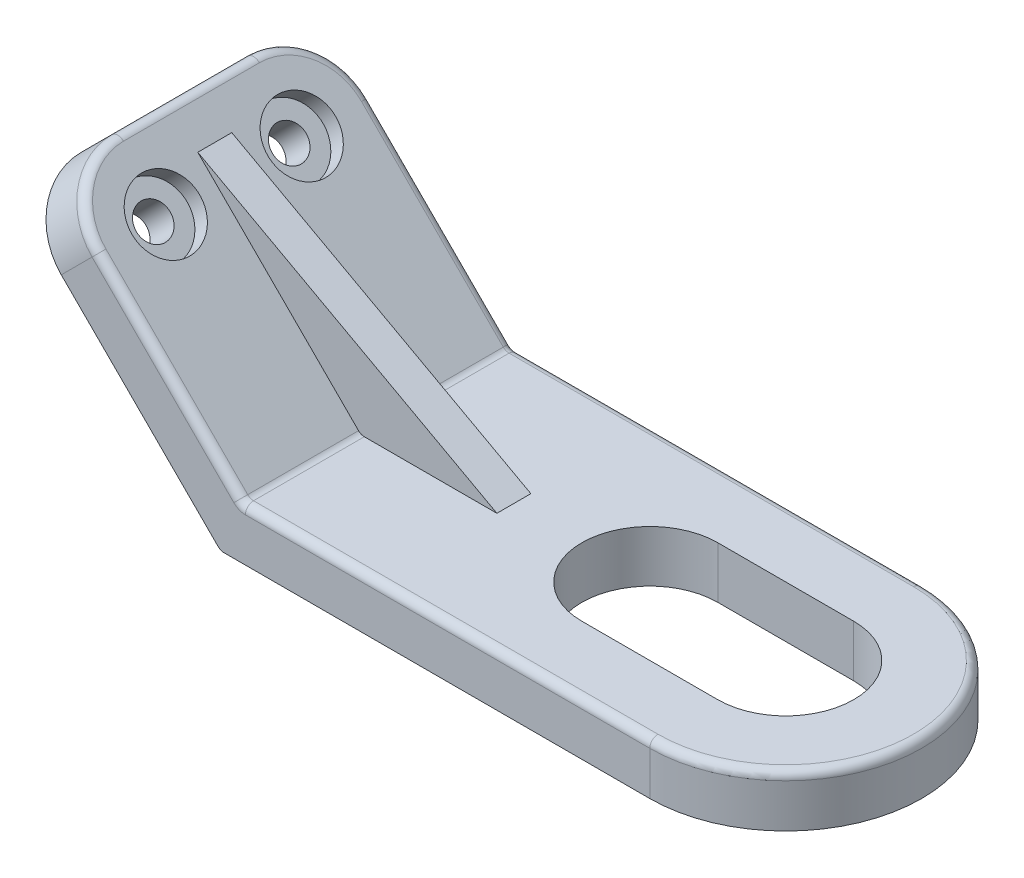
from build123d import *

# Parameters (mm, degrees)
EXTRUDE_THIN1_DEPTH                                 = 25.4
CUT_EXTRUDE1_DEPTH                                  = 111.716033166
CBORE_FOR_00_BINDING_HEAD_MACHINE_SCREW_D           = 6.35
CBORE_FOR_00_BINDING_HEAD_MACHINE_SCREW_CBORE_D     = 12.7
CBORE_FOR_00_BINDING_HEAD_MACHINE_SCREW_CBORE_DEPTH = 3.302
RIB1_REACH                                          = 112.716
SKETCH6_WALL_W                                      = 287.08428389
SKETCH6_WALL_H                                      = 6.35
FILLET1_R                                           = 12.7
FILLET2_R                                           = 1.524
FILLET3_RADIUS                                      = 25.4
FILLET3_LENGTH                                      = 9.652
FILLET4_R                                           = 1.524


with BuildPart() as part:
    # Sketch2 → Extrude-Thin1 (new, symmetric)
    with BuildSketch(Plane.XY):
        Polygon((-35.921024484, 35.921024484), (0, 0), (101.6, 0), (101.6, -9.652), (-3.997989304, -9.652), (-42.746019136, 29.096029832), align=None)
    extrude(amount=EXTRUDE_THIN1_DEPTH, both=True)

    # Sketch3 → Cut-Extrude1 (cut, through all)
    with BuildSketch(Plane(origin=(0, 0, 0), x_dir=(1, 0, 0), z_dir=(0, 1, 0))):
        with BuildLine():
            Line((50.8, 12.7), (76.2, 12.7))
            ThreePointArc((76.2, 12.7), (88.9, 0), (76.2, -12.7))
            Line((76.2, -12.7), (50.8, -12.7))
            ThreePointArc((50.8, -12.7), (38.1, 0), (50.8, 12.7))
        make_face()
    extrude(amount=-CUT_EXTRUDE1_DEPTH, mode=Mode.SUBTRACT)

    # CBORE for #00 Binding Head Machine Screw1 (through all)
    with Locations(Plane(origin=(0, 0, 0), x_dir=(0.7071067811865513, -0.7071067811865438, 0), z_dir=(0.7071067811865438, 0.7071067811865513, 0))):
        with Locations((-38.1, -12.7)):
            cbore_for_00_binding_head_machine_screw = CounterBoreHole(CBORE_FOR_00_BINDING_HEAD_MACHINE_SCREW_D / 2, CBORE_FOR_00_BINDING_HEAD_MACHINE_SCREW_CBORE_D / 2, CBORE_FOR_00_BINDING_HEAD_MACHINE_SCREW_CBORE_DEPTH)

    # Mirror1: CBORE for #00 Binding Head Machine Screw1 across plane
    add(cbore_for_00_binding_head_machine_screw.mirror(Plane.XY), mode=Mode.SUBTRACT)

    # Sketch6 wall → Rib1 (add, up to next)
    with BuildSketch(Plane(origin=(-2.54, 15.24, 0), x_dir=(0.877895572914, -0.478852130681, 0), z_dir=(0.478852130681, 0.877895572914, 0)), mode=Mode.PRIVATE) as rib1_sk1:
        Rectangle(SKETCH6_WALL_W, SKETCH6_WALL_H)
    rib1_tool1 = extrude(rib1_sk1.sketch, amount=-RIB1_REACH, mode=Mode.PRIVATE) - part.part
    add(rib1_tool1.solids().sort_by_distance((-2.54, 15.24, 0))[0])

    # Fillet1
    fillet1_edges = [part.edges().sort_by_distance(p)[0] for p in [
        (-39.33352181, 32.508527158, -25.4),
        (-39.33352181, 32.508527158, 25.4),
    ]]
    fillet(fillet1_edges, radius=FILLET1_R)

    # Fillet2
    fillet2_edges = [part.edges().sort_by_distance(p)[0] for p in [
        (0, 0, -14.2875),
        (0, 0, 14.2875),
        (-3.997989304, -9.652, 0),
    ]]
    fillet(fillet2_edges, radius=FILLET2_R)

    # Fillet3: full round fillet: the end face becomes a half cylinder, R = half its width
    fillet3_face = Plane((101.6, -4.826, 0), x_dir=(0, -1, 0), z_dir=(1, 0, 0))  # on the end face: x along it, z out of the body
    fillet3_slab = fillet3_face.offset(-FILLET3_RADIUS / 2) * Box(FILLET3_LENGTH, 2 * FILLET3_RADIUS, FILLET3_RADIUS, mode=Mode.PRIVATE)  # the body's end, R deep
    fillet3_round = Plane((76.2, -4.826, 0), x_dir=(1, 0, 0), z_dir=(0, -1, 0)) * Cylinder(FILLET3_RADIUS, FILLET3_LENGTH, mode=Mode.PRIVATE)  # its axis R under the face
    add(fillet3_slab - fillet3_round, mode=Mode.SUBTRACT)

    # Fillet4
    fillet4_edges = [part.edges().sort_by_distance(p)[0] for p in [
        (38.415630735, 0, 25.4),
        (38.415630735, 0, -25.4),
        (101.6, 0, 0),
        (-35.921024484, 35.921024484, 0),
        (-33.290768363, 33.290768363, 21.680256121),
        (-33.290768363, 33.290768363, -21.680256121),
        (-13.693568814, 13.693568814, -25.4),
        (-13.693568814, 13.693568814, 25.4),
        (0.048051918, 0.116007592, -25.4),
        (0.048051918, 0.116007592, 25.4),
    ]]
    fillet(fillet4_edges, radius=FILLET4_R)


solid = part.part
